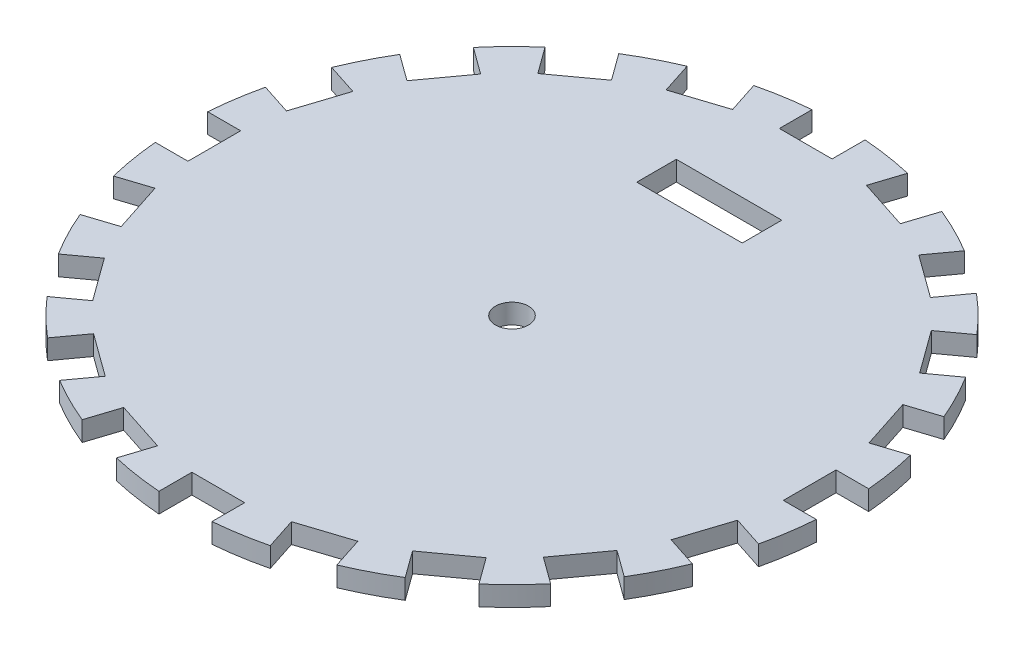
from build123d import *

# Parameters (mm, degrees)
SKETCH1_R           = 50
BOSS_EXTRUDE3_DEPTH = 3
SKETCH7_R           = 2.5
CUT_EXTRUDE1_DEPTH  = 3
CUT_EXTRUDE4_START  = -3
CUT_EXTRUDE4_DEPTH  = 74.774289117
CIRPATTERN5_COUNT   = 20
SKETCH9_W           = 16
SKETCH9_H           = 6
CUT_EXTRUDE5_DEPTH  = 3


with BuildPart() as part:
    # Sketch1 → Boss-Extrude3 (new body)
    with BuildSketch(Plane(origin=(0, 0, 0), x_dir=(1, 0, 0), z_dir=(0, 1, 0))):
        with Locations(Location((0, 0, 0), (0, 0, 270))):
            Circle(SKETCH1_R)
    extrude(amount=BOSS_EXTRUDE3_DEPTH)

    # Sketch7 → Cut-Extrude1 (cut)
    with BuildSketch(Plane(origin=(0, 3, 0), x_dir=(1, 0, 0), z_dir=(0, 1, 0))):
        with Locations(Location((0, 0, 0), (0, 0, 270))):
            Circle(SKETCH7_R)
    extrude(amount=-CUT_EXTRUDE1_DEPTH, mode=Mode.SUBTRACT)

    # Sketch8 → Cut-Extrude4 (cut)
    with BuildSketch(Plane(origin=(0, 3, 0), x_dir=(1, 0, 0), z_dir=(0, 1, 0)).offset(CUT_EXTRUDE4_START)):
        Polygon((-4.300866829, 287.072728165), (-4.300866829, 49.814682018), (-4.300866829, 44.862976383), (3.699133171, 44.862976383), (3.699133171, 49.862976383), (3.699133171, 287.12102253), (0.83462867, 761.628468689), (-7.16537133, 761.580174324), align=None)
    cut_extrude4 = extrude(amount=CUT_EXTRUDE4_DEPTH, mode=Mode.SUBTRACT)

    # CirPattern5: Cut-Extrude4 ×20 about axis
    cirpattern5_axis = Axis((0, 3, 0), (0, 1, 0))
    for i in range(1, CIRPATTERN5_COUNT):
        add(cut_extrude4.rotate(cirpattern5_axis, i * 360 / CIRPATTERN5_COUNT), mode=Mode.SUBTRACT)

    # Sketch9 → Cut-Extrude5 (cut)
    with BuildSketch(Plane(origin=(0, 3, 0), x_dir=(1, 0, 0), z_dir=(0, 1, 0))):
        with Locations((-0.069626974, 30)):
            Rectangle(SKETCH9_W, SKETCH9_H)
    extrude(amount=-CUT_EXTRUDE5_DEPTH, mode=Mode.SUBTRACT)


solid = part.part
